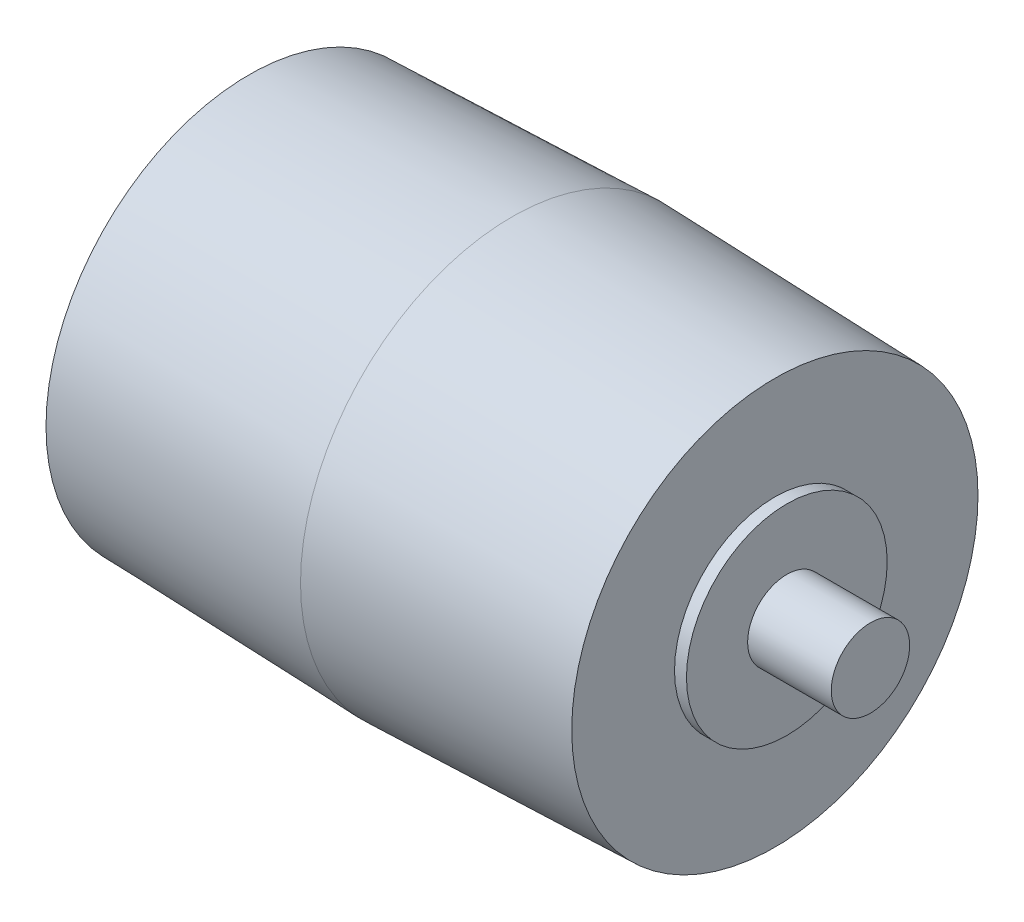
from build123d import *


with BuildPart() as part:
    # Sketch1 → Revolve1 (revolve)
    with BuildSketch(Plane.XY, mode=Mode.PRIVATE) as revolve1_sk:
        Polygon((-9.525, 0), (-9.525, 1.0414), (-7.3025, 1.0414), (-7.3025, 2.667), (-6.985, 2.667), (-6.985, 5.3975), (0, 5.61975), (6.985, 5.3975), (6.985, 2.667), (7.3025, 2.667), (7.3025, 1.0414), (9.525, 1.0414), (9.525, 0), align=None)
    revolve(revolve1_sk.sketch.rotate(Axis((-9.525, 0, 0), (1, 0, 0)), 90), axis=Axis((-9.525, 0, 0), (1, 0, 0)))


solid = part.part
